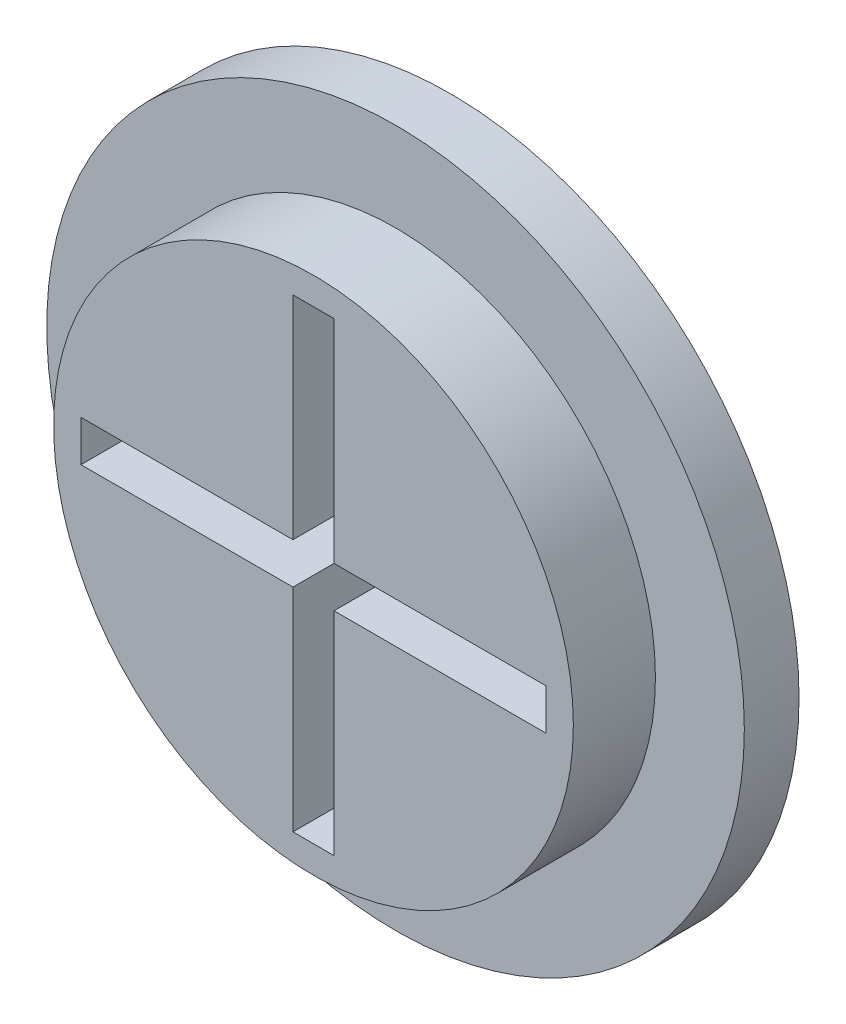
from build123d import *

# Parameters (mm, degrees)
OUTER_SKETCH_R           = 12.75
OUTER_DEPTH              = 2
INNER_SKETCH_R           = 9.5
INNER_DEPTH              = 3
CUT_OUT_SKETCH_W         = 7.75
CUT_OUT_SKETCH_H         = 1.5
CUT_OUT_SKETCH_W_2       = 1.5
CUT_OUT_SKETCH_H_2       = 7.75
ODEBRAT_VYSUNUT_M1_DEPTH = 19.711627401


with BuildPart() as part:
    # Outer sketch → Outer (new body)
    with BuildSketch(Plane.XY):
        Circle(OUTER_SKETCH_R)
    extrude(amount=OUTER_DEPTH)

    # Inner sketch → Inner (add)
    with BuildSketch(Plane.XY.offset(2)):
        Circle(INNER_SKETCH_R)
    extrude(amount=INNER_DEPTH)

    # Cut out sketch → Odebrat vysunutím1 (cut, through all)
    with BuildSketch(Plane.XY.offset(5)):
        with Locations((-4.625, 0)):
            Rectangle(CUT_OUT_SKETCH_W, CUT_OUT_SKETCH_H)
        with Locations((0, 4.625)):
            Rectangle(CUT_OUT_SKETCH_W_2, CUT_OUT_SKETCH_H_2)
        Rectangle(CUT_OUT_SKETCH_W_2, CUT_OUT_SKETCH_H)
        with Locations((0, -4.625)):
            Rectangle(CUT_OUT_SKETCH_W_2, CUT_OUT_SKETCH_H_2)
        with Locations((4.625, 0)):
            Rectangle(CUT_OUT_SKETCH_W, CUT_OUT_SKETCH_H)
    extrude(amount=-ODEBRAT_VYSUNUT_M1_DEPTH, mode=Mode.SUBTRACT)


solid = part.part
